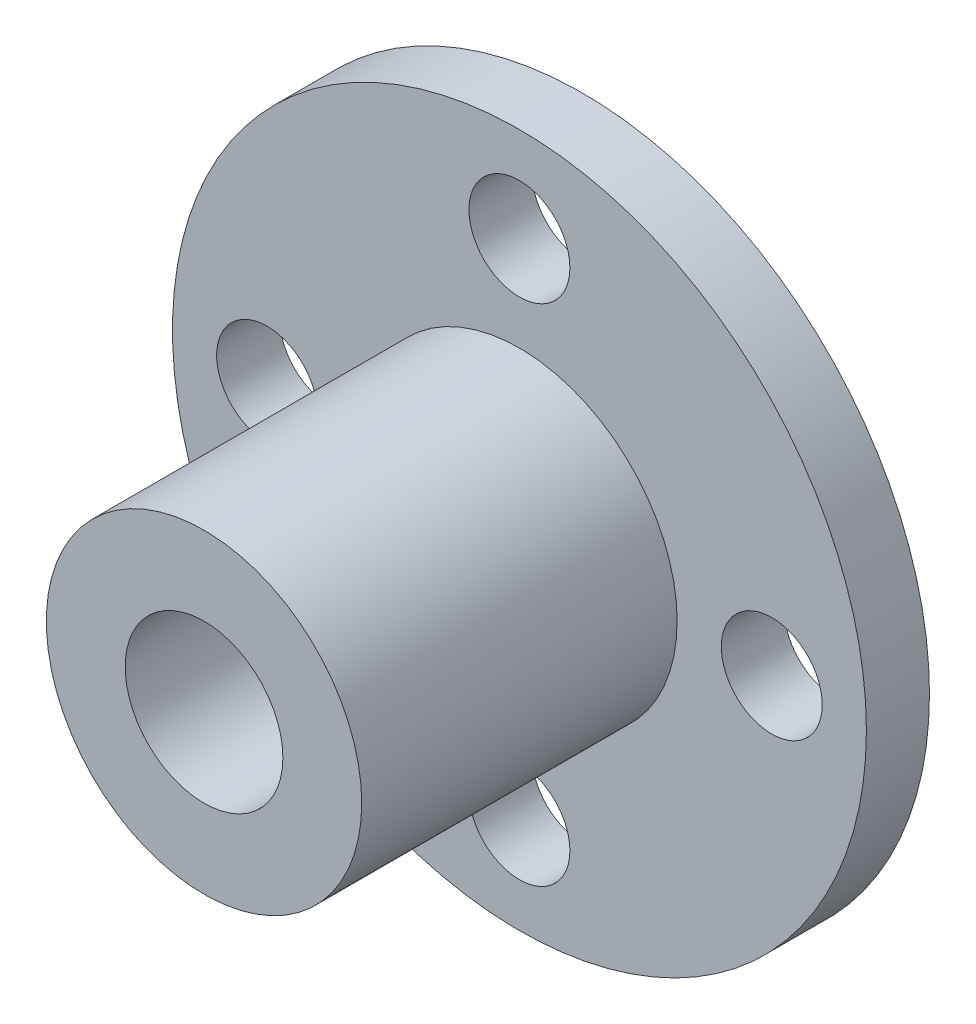
from build123d import *

# Parameters (mm, degrees)
SKETCH_1_R                  = 11
EXTRUDE_1_DEPTH             = 2
SKETCH_2_R                  = 5
EXTRUDE_2_DEPTH             = 10
SKETCH_3_R                  = 2.5
CUT_EXTRUDE_1_DEPTH         = 20.646882704
HOLE_WIZARD_3_2_3_2_1_D     = 3.2
HOLE_WIZARD_3_2_3_2_1_DEPTH = 10
HOLE_WIZARD_3_2_3_2_1_TIP   = 0.96137699


with BuildPart() as part:
    # 草图1 → 凸台-拉伸1 (new body)
    with BuildSketch(Plane.XY):
        Circle(SKETCH_1_R)
    extrude(amount=EXTRUDE_1_DEPTH)

    # 草图2 → 凸台-拉伸2 (add)
    with BuildSketch(Plane.XY.offset(2)):
        Circle(SKETCH_2_R)
    extrude(amount=EXTRUDE_2_DEPTH)

    # 草图3 → 切除-拉伸1 (cut, through all)
    with BuildSketch(Plane.XY.offset(12)):
        Circle(SKETCH_3_R)
    extrude(amount=-CUT_EXTRUDE_1_DEPTH, mode=Mode.SUBTRACT)

    # Ø3.2 (3.2) 直径孔1
    with Locations(Plane.XY.offset(2)):
        with Locations((8, 0), (-8, 0), (0, -8), (0, 8)):
            Hole(HOLE_WIZARD_3_2_3_2_1_D / 2, depth=HOLE_WIZARD_3_2_3_2_1_DEPTH)
            with Locations((0, 0, -(HOLE_WIZARD_3_2_3_2_1_DEPTH + HOLE_WIZARD_3_2_3_2_1_TIP / 2))):  # 118° drill point
                Cone(0, HOLE_WIZARD_3_2_3_2_1_D / 2, HOLE_WIZARD_3_2_3_2_1_TIP, mode=Mode.SUBTRACT)


solid = part.part
